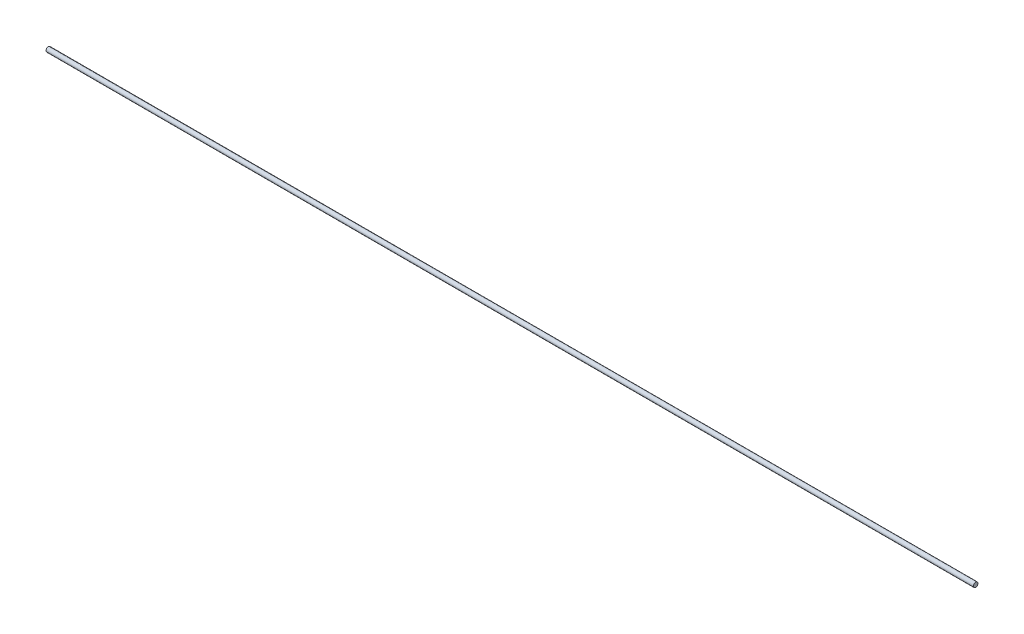
from build123d import *

# Parameters (mm, degrees)
SKETCH1_R           = 0.125
BOSS_EXTRUDE1_DEPTH = 50


with BuildPart() as part:
    # Sketch1 → Boss-Extrude1 (new body)
    with BuildSketch(Plane(origin=(0, 0, 0), x_dir=(0, 0, -1), z_dir=(1, 0, 0))):
        Circle(SKETCH1_R)
    extrude(amount=BOSS_EXTRUDE1_DEPTH)


solid = part.part
